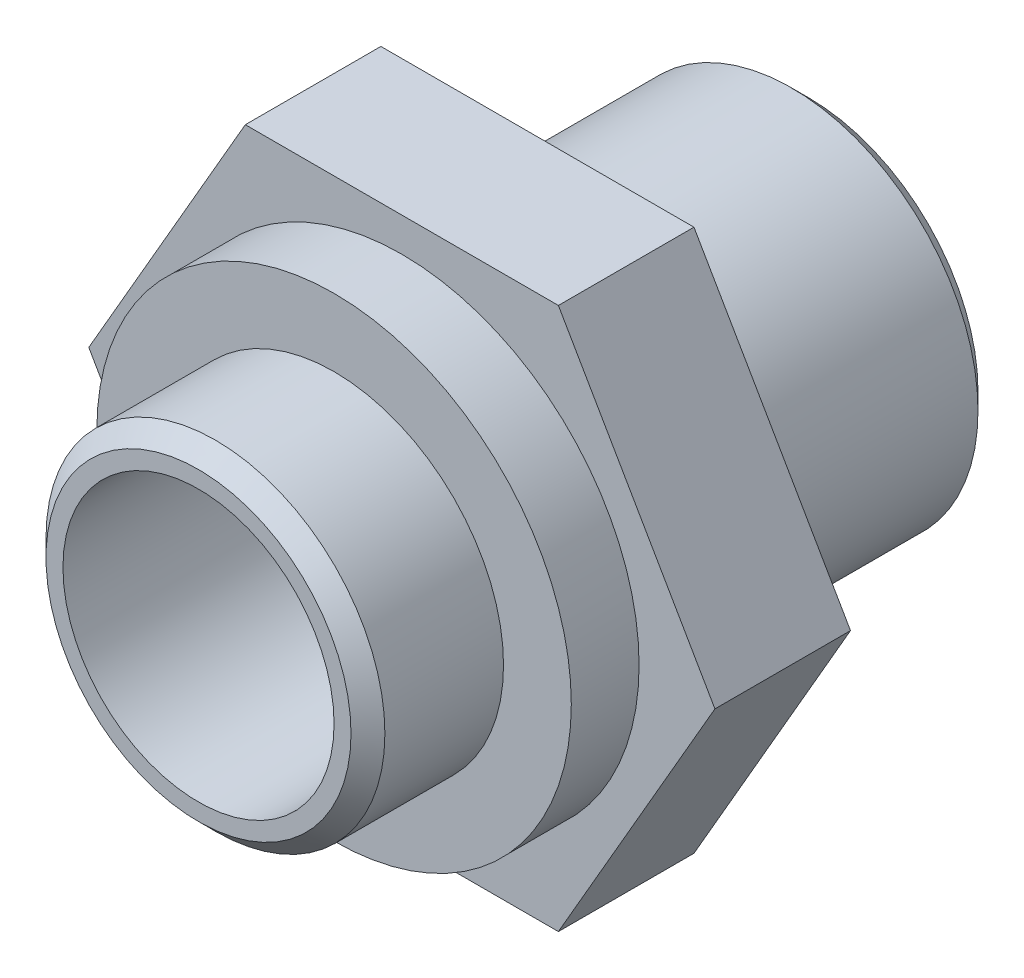
from build123d import *

# Parameters (mm, degrees)
SKETCH2_R           = 2.75
BOSS_EXTRUDE1_DEPTH = 4
BOSS_EXTRUDE2_DEPTH = 2
SKETCH4_R           = 3.5
BOSS_EXTRUDE3_DEPTH = 1
SKETCH5_R           = 2.5
BOSS_EXTRUDE5_DEPTH = 2
SKETCH7_R           = 2
CUT_EXTRUDE1_DEPTH  = 11.878112581
CHAMFER1_SIZE       = 0.25


with BuildPart() as part:
    # Sketch2 → Boss-Extrude1 (new body)
    with BuildSketch(Plane.XY):
        Circle(SKETCH2_R)
    extrude(amount=BOSS_EXTRUDE1_DEPTH)

    # Sketch3 → Boss-Extrude2 (add)
    with BuildSketch(Plane.XY.offset(4)):
        Polygon((4.618802154, 0), (2.309401077, 4), (-2.309401077, 4), (-4.618802154, 0), (-2.309401077, -4), (2.309401077, -4), align=None)
    extrude(amount=BOSS_EXTRUDE2_DEPTH)

    # Sketch4 → Boss-Extrude3 (add)
    with BuildSketch(Plane.XY.offset(6)):
        Circle(SKETCH4_R)
    extrude(amount=BOSS_EXTRUDE3_DEPTH)

    # Sketch5 → Boss-Extrude5 (add)
    with BuildSketch(Plane.XY.offset(7)):
        Circle(SKETCH5_R)
    extrude(amount=BOSS_EXTRUDE5_DEPTH)

    # Sketch7 → Cut-Extrude1 (cut, through all)
    with BuildSketch(Plane.XY.offset(9)):
        Circle(SKETCH7_R)
    extrude(amount=-CUT_EXTRUDE1_DEPTH, mode=Mode.SUBTRACT)

    # Chamfer1
    chamfer1_edges = [part.edges().sort_by_distance(p)[0] for p in [
        (-2.75, 0, 0),
        (-2.5, 0, 9),
    ]]
    chamfer(chamfer1_edges, length=CHAMFER1_SIZE)


solid = part.part
